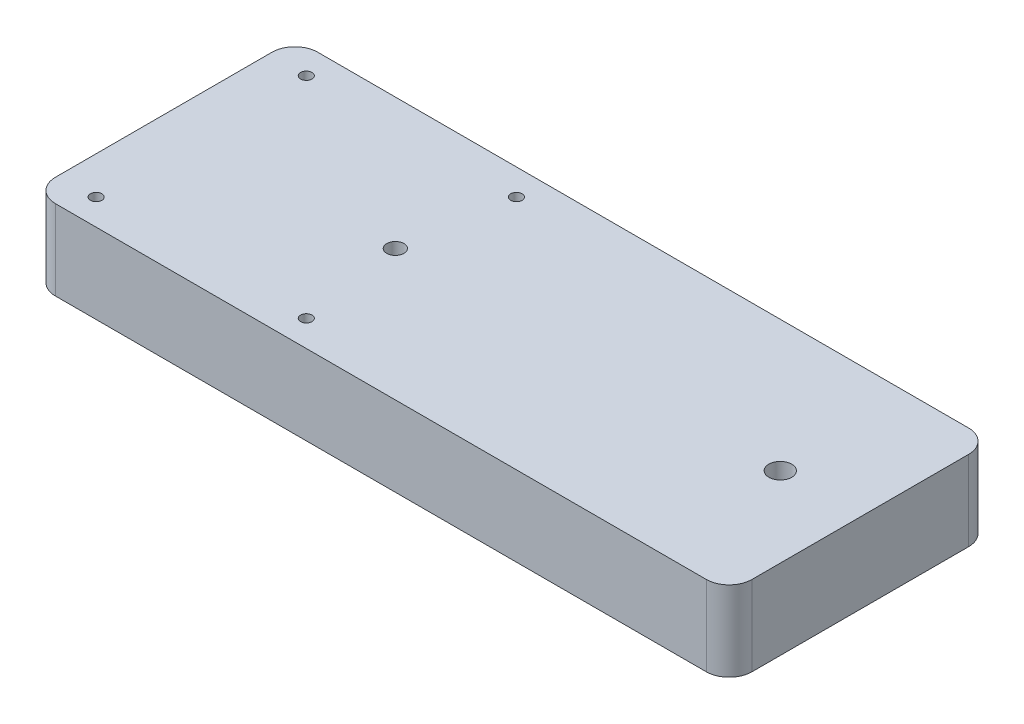
from build123d import *

# Parameters (mm, degrees)
BOSS_EXTRUDE1_DEPTH = 35
SKETCH2_R           = 5
CUT_EXTRUDE1_DEPTH  = 35
SKETCH3_R           = 2.5
SKETCH3_R_2         = 3.75
CUT_EXTRUDE2_DEPTH  = 252.528008709


with BuildPart() as part:
    # Sketch1 → Boss-Extrude1 (new body)
    with BuildSketch(Plane(origin=(0, 0, 0), x_dir=(1, 0, 0), z_dir=(0, 1, 0))):
        with BuildLine():
            Line((-52.381351684, 57.381351684), (62.381351684, 57.381351684))
            Line((62.381351684, 57.381351684), (232.381351684, 57.381351684))
            ThreePointArc((232.381351684, 57.381351684), (239.452419496, 54.452419496), (242.381351684, 47.381351684))
            Line((242.381351684, 47.381351684), (242.381351684, -47.381351684))
            ThreePointArc((242.381351684, -47.381351684), (239.452419496, -54.452419496), (232.381351684, -57.381351684))
            Line((232.381351684, -57.381351684), (62.381351684, -57.381351684))
            Line((62.381351684, -57.381351684), (-52.381351684, -57.381351684))
            ThreePointArc((-52.381351684, -57.381351684), (-59.452419496, -54.452419496), (-62.381351684, -47.381351684))
            Line((-62.381351684, -47.381351684), (-62.381351684, 47.381351684))
            ThreePointArc((-62.381351684, 47.381351684), (-59.452419496, 54.452419496), (-52.381351684, 57.381351684))
        make_face()
    extrude(amount=BOSS_EXTRUDE1_DEPTH)

    # Sketch2 → Cut-Extrude1 (cut)
    with BuildSketch(Plane(origin=(0, 35, 0), x_dir=(1, 0, 0), z_dir=(0, 1, 0))):
        with Locations(Location((207.381351684, 0, 0), (0, 0, 270))):
            Circle(SKETCH2_R)
    extrude(amount=-CUT_EXTRUDE1_DEPTH, mode=Mode.SUBTRACT)

    # Sketch3 → Cut-Extrude2 (cut, through all)
    with BuildSketch(Plane(origin=(0, 35, 0), x_dir=(1, 0, 0), z_dir=(0, 1, 0))):
        with Locations(Location((45.961940777, 45.961940777, 0), (0, 0, 270))):
            Circle(SKETCH3_R)
        with Locations(Location((45.961940777, -45.961940777, 0), (0, 0, 270))):
            Circle(SKETCH3_R)
        with Locations(Location((-45.961940777, -45.961940777, 0), (0, 0, 270))):
            Circle(SKETCH3_R)
        with Locations(Location((-45.961940777, 45.961940777, 0), (0, 0, 270))):
            Circle(SKETCH3_R)
        with Locations(Location((38.961940777, 0, 0), (0, 0, 270))):
            Circle(SKETCH3_R_2)
    extrude(amount=-CUT_EXTRUDE2_DEPTH, mode=Mode.SUBTRACT)


solid = part.part
